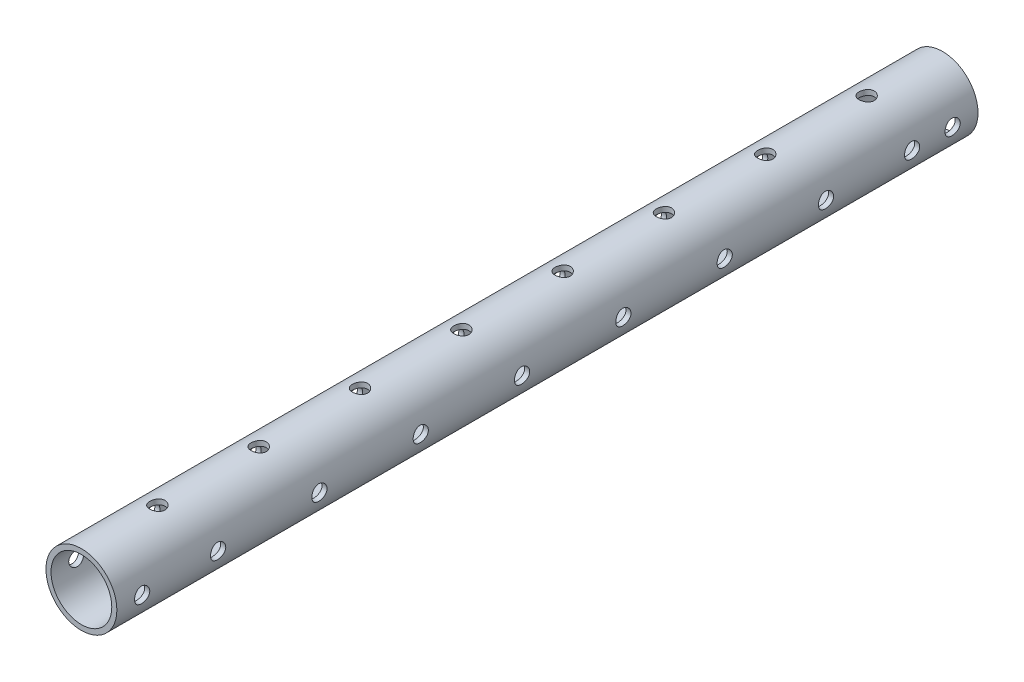
from build123d import *

# Parameters (mm, degrees)
SKETCH_1_R               = 7
SKETCH_1_R_2             = 6
EXTRUDE_1_DEPTH          = 170
CUT_EXTRUDE_1_DEPTH      = 171.287991356
CUT_EXTRUDE_1_DEPTH_BACK = 171.287991356
SKETCH_3_R               = 1.5
CUT_EXTRUDE_2_DEPTH      = 171.287991464
CUT_EXTRUDE_2_DEPTH_BACK = 171.287991464
SKETCH_4_R               = 1.5


with BuildPart() as part:
    # 草图1 → 凸台-拉伸1 (new body)
    with BuildSketch(Plane.XY):
        Circle(SKETCH_1_R)
        Circle(SKETCH_1_R_2, mode=Mode.SUBTRACT)
    extrude(amount=EXTRUDE_1_DEPTH)

    # 草图3 → 切除-拉伸1 (cut, two sides: drawn at the far end of the back side and taken through both)
    with BuildSketch(Plane(origin=(0, 0, 0), x_dir=(0, 0, -1), z_dir=(1, 0, 0)).offset(-CUT_EXTRUDE_1_DEPTH_BACK)):
        with Locations((-165, 0)):
            Circle(SKETCH_3_R)
        with Locations((-5, 0)):
            Circle(SKETCH_3_R)
        with Locations((-13, 0)):
            Circle(SKETCH_3_R)
        with Locations((-30, 0)):
            Circle(SKETCH_3_R)
        with Locations((-50, 0)):
            Circle(SKETCH_3_R)
        with Locations((-70, 0)):
            Circle(SKETCH_3_R)
        with Locations((-90, 0)):
            Circle(SKETCH_3_R)
        with Locations((-110, 0)):
            Circle(SKETCH_3_R)
        with Locations((-130, 0)):
            Circle(SKETCH_3_R)
        with Locations((-150, 0)):
            Circle(SKETCH_3_R)
    extrude(amount=CUT_EXTRUDE_1_DEPTH + CUT_EXTRUDE_1_DEPTH_BACK, mode=Mode.SUBTRACT)

    # 草图4 → 切除-拉伸2 (cut, two sides: drawn at the far end of the back side and taken through both)
    with BuildSketch(Plane(origin=(0, 0, 0), x_dir=(1, 0, 0), z_dir=(0, 1, 0)).offset(-CUT_EXTRUDE_2_DEPTH_BACK)):
        with Locations(Location((0, -15, 0), (0, 0, 270))):
            Circle(SKETCH_4_R)
        with Locations(Location((0, -35, 0), (0, 0, 270))):
            Circle(SKETCH_4_R)
        with Locations(Location((0, -55, 0), (0, 0, 270))):
            Circle(SKETCH_4_R)
        with Locations(Location((0, -75, 0), (0, 0, 270))):
            Circle(SKETCH_4_R)
        with Locations(Location((0, -95, 0), (0, 0, 270))):
            Circle(SKETCH_4_R)
        with Locations(Location((0, -115, 0), (0, 0, 270))):
            Circle(SKETCH_4_R)
        with Locations(Location((0, -135, 0), (0, 0, 270))):
            Circle(SKETCH_4_R)
        with Locations(Location((0, -155, 0), (0, 0, 270))):
            Circle(SKETCH_4_R)
    extrude(amount=CUT_EXTRUDE_2_DEPTH + CUT_EXTRUDE_2_DEPTH_BACK, mode=Mode.SUBTRACT)


solid = part.part
